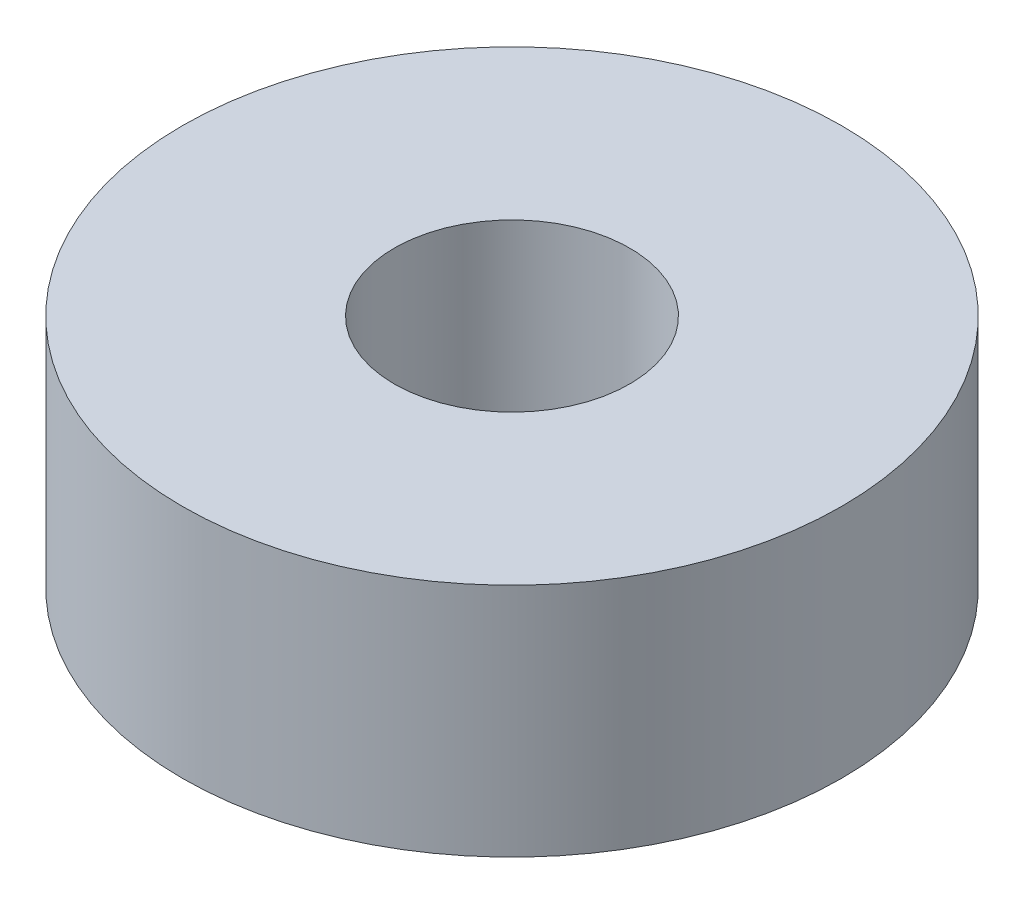
from build123d import *

# Parameters (mm, degrees)
SKETCH1_R           = 7
SKETCH1_R_2         = 2.5
BOSS_EXTRUDE1_DEPTH = 2.5


with BuildPart() as part:
    # Sketch1 → Boss-Extrude1 (new, symmetric)
    with BuildSketch(Plane(origin=(0, 0, 0), x_dir=(1, 0, 0), z_dir=(0, 1, 0))):
        with Locations(Location((0, 0, 0), (0, 0, 270))):
            Circle(SKETCH1_R)
        with Locations(Location((0, 0, 0), (0, 0, 270))):
            Circle(SKETCH1_R_2, mode=Mode.SUBTRACT)
    extrude(amount=BOSS_EXTRUDE1_DEPTH, both=True)


solid = part.part
